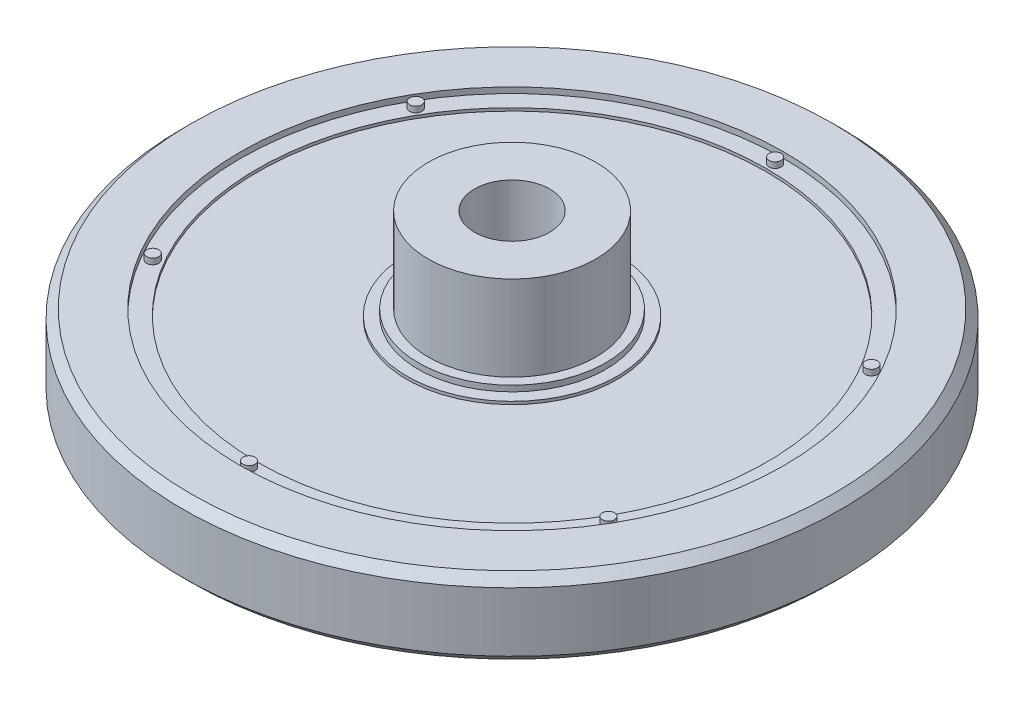
from build123d import *

# Parameters (mm, degrees)
SKETCH3_R           = 0.21
BOSS_EXTRUDE1_DEPTH = 0.2
CIRPATTERN1_COUNT   = 6


with BuildPart() as part:
    # Sketch2 → Revolve1 (revolve)
    with BuildSketch(Plane.XY, mode=Mode.PRIVATE) as revolve1_sk:
        Polygon((-1.81, 2.68), (-1.81, 4.68), (-1.56, 4.68), (-1.56, 6.78), (-1.3, 6.78), (-1.3, 9.32), (-2.9, 9.32), (-2.9, 6.38), (-3.24, 6.38), (-3.24, 6.18), (-3.64, 6.18), (-3.64, 6.08), (-8.8, 6.08), (-8.8, 6.18), (-9.4, 6.18), (-9.4, 6.38), (-11.1, 6.38), (-11.4, 6.08), (-11.4, 4.03), (-11.1, 3.73), (-9.4, 3.73), (-2.54, 4.34), (-2.54, 4.289146726), (-2.61, 4.289146726), (-2.61, 4.03), (-2.5, 4.03), (-2.5, 2.68), align=None)
    revolve(revolve1_sk.sketch.rotate(Axis((0, 0, 0), (0, 1, 0)), 270), axis=Axis((0, 0, 0), (0, 1, 0)))

    # Sketch3 → Boss-Extrude1 (add)
    with BuildSketch(Plane(origin=(0, 6.18, 0), x_dir=(1, 0, 0), z_dir=(0, 1, 0))):
        with Locations(Location((0, 9.1, 0), (0, 0, 90))):
            Circle(SKETCH3_R)
    boss_extrude1 = extrude(amount=BOSS_EXTRUDE1_DEPTH)

    # CirPattern1: Boss-Extrude1 ×6 about axis
    cirpattern1_axis = Axis((0, 0, 0), (0, 1, 0))
    for i in range(1, CIRPATTERN1_COUNT):
        add(boss_extrude1.rotate(cirpattern1_axis, i * 360 / CIRPATTERN1_COUNT))


solid = part.part
